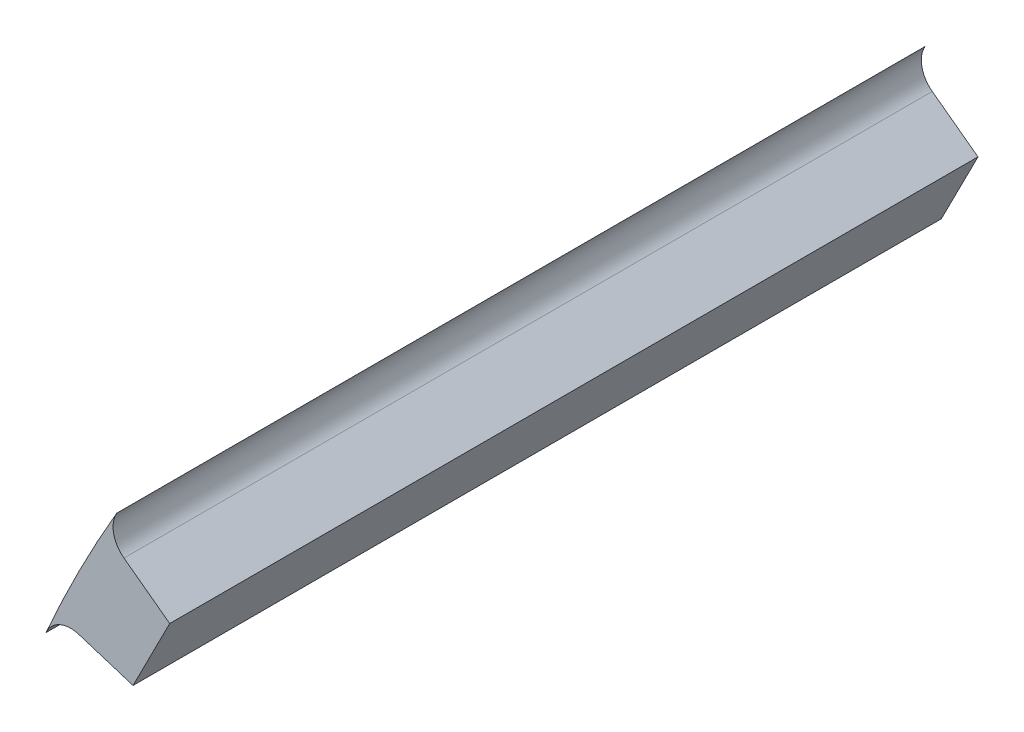
from build123d import *

# Parameters (mm, degrees)
BOSS_EXTRUDE1_DEPTH = 30


with BuildPart() as part:
    # Sketch2 → Boss-Extrude1 (new body)
    with BuildSketch(Plane(origin=(0, 0, -30), x_dir=(-1, 0, 0), z_dir=(0, 0, -1))):
        with BuildLine():
            Line((44.571295977, 20.637196951), (42.558292386, 20.001043701))
            Line((42.558292386, 20.001043701), (41.196320887, 22.674063274))
            Line((41.196320887, 22.674063274), (42.8941935, 23.92869589))
            ThreePointArc((42.8941935, 23.92869589), (43.279434932, 24.531672134), (43.163162714, 25.237697687))
            ThreePointArc((43.163162714, 25.237697687), (44.550326209, 22.699524987), (45.788396813, 20.085385664))
            ThreePointArc((45.788396813, 20.085385664), (45.285553237, 20.594443273), (44.571295977, 20.637196951))
        make_face()
    extrude(amount=-BOSS_EXTRUDE1_DEPTH)


solid = part.part
